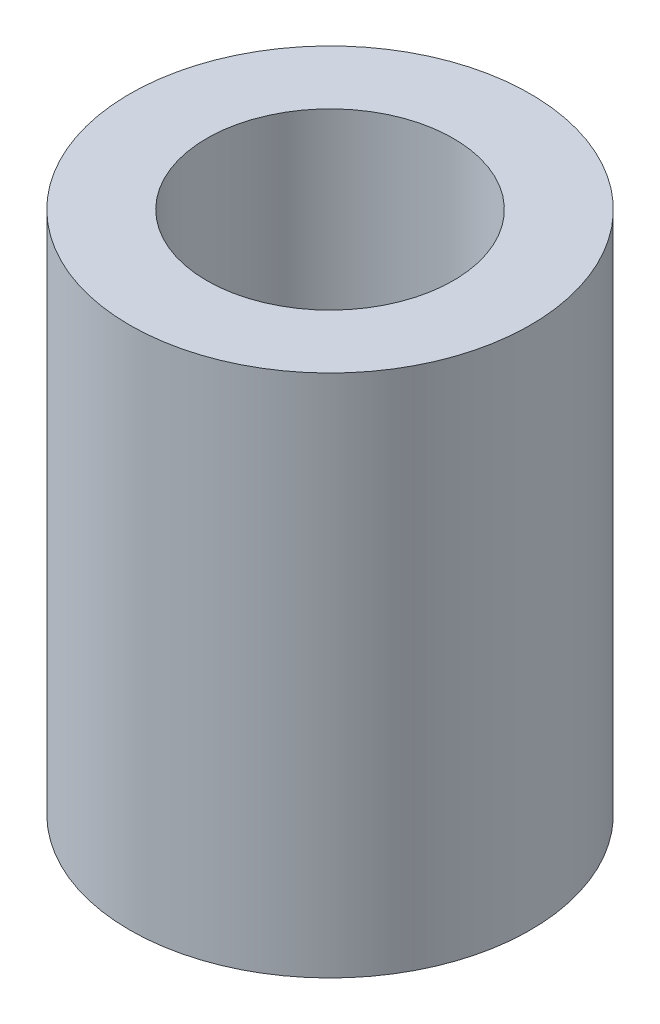
from build123d import *

# Parameters (mm, degrees)
SKETCH1_R           = 6.5
SKETCH1_R_2         = 4
BOSS_EXTRUDE1_DEPTH = 17


with BuildPart() as part:
    # Sketch1 → Boss-Extrude1 (new body)
    with BuildSketch(Plane(origin=(0, 0, 0), x_dir=(1, 0, 0), z_dir=(0, 1, 0))):
        with Locations(Location((0, 0, 0), (0, 0, 270))):
            Circle(SKETCH1_R)
        with Locations(Location((0, 0, 0), (0, 0, 270))):
            Circle(SKETCH1_R_2, mode=Mode.SUBTRACT)
    extrude(amount=BOSS_EXTRUDE1_DEPTH)


solid = part.part
